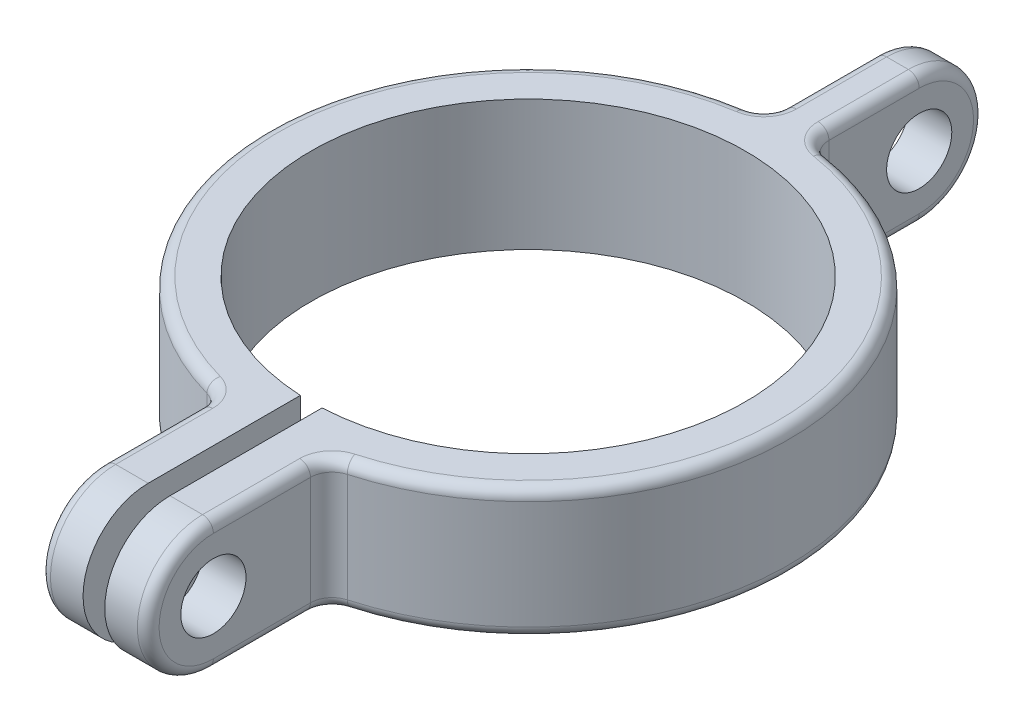
from build123d import *

# Parameters (mm, degrees)
SKETCH1_R          = 38.1
SKETCH1_R_2        = 31.75
EXTRUDE1_DEPTH     = 19.05
SKETCH2_W          = 3.175
SKETCH2_H          = 40.64
CUT_EXTRUDE1_DEPTH = 58.15
EXTRUDE2_DEPTH     = 6.35
SKETCH6_R          = 4.7625
CUT_EXTRUDE3_DEPTH = 81.687067836
EXTRUDE4_DEPTH     = 3.175
FILLET4_R          = 3.175
SKETCH10_R         = 4.7625
CUT_EXTRUDE6_DEPTH = 79.094674114
FILLET5_R          = 1.5875


with BuildPart() as part:
    # Sketch1 → Extrude1 (new body)
    with BuildSketch(Plane(origin=(0, 0, 0), x_dir=(1, 0, 0), z_dir=(0, 1, 0))):
        with Locations(Location((0, 0, 0), (0, 0, 90))):
            Circle(SKETCH1_R)
        with Locations(Location((0, 0, 0), (0, 0, 90))):
            Circle(SKETCH1_R_2, mode=Mode.SUBTRACT)
    extrude(amount=EXTRUDE1_DEPTH)

    # Sketch2 → Cut-Extrude1 (cut, through all)
    with BuildSketch(Plane(origin=(0, 19.05, 0), x_dir=(-1, 0, 0), z_dir=(0, 1, 0))):
        with Locations((0, 20.32)):
            Rectangle(SKETCH2_W, SKETCH2_H)
    extrude(amount=-CUT_EXTRUDE1_DEPTH, mode=Mode.SUBTRACT)

    # Sketch3 → Extrude2 (add)
    with BuildSketch(Plane.ZY.offset(-1.5875)):
        with BuildLine():
            Line((31.710287664, 19.05), (53.941912716, 19.05))
            ThreePointArc((53.941912716, 19.05), (63.466912716, 9.525), (53.941912716, 0))
            Line((53.941912716, 0), (31.710287664, 0))
            Line((31.710287664, 0), (31.710287664, 19.05))
        make_face()
    extrude2 = extrude(amount=-EXTRUDE2_DEPTH)

    # Mirror1: Extrude2 across plane
    add(extrude2.mirror(Plane(origin=(0, 0, 0), x_dir=(0, 0, 1), z_dir=(1, 0, 0))))

    # Sketch6 → Cut-Extrude3 (cut, through all)
    with BuildSketch(Plane(origin=(7.9375, 0, 0), x_dir=(0, 0, -1), z_dir=(1, 0, 0))):
        with Locations((-53.941912716, 9.525)):
            Circle(SKETCH6_R)
    extrude(amount=-CUT_EXTRUDE3_DEPTH, mode=Mode.SUBTRACT)

    # Sketch7 → Extrude4 (add, symmetric)
    with BuildSketch(Plane(origin=(0, 0, 0), x_dir=(0, 0, -1), z_dir=(1, 0, 0))):
        with BuildLine():
            Line((31.75, 19.05), (53.975, 19.05))
            ThreePointArc((53.975, 19.05), (63.5, 9.525), (53.975, 0))
            Line((53.975, 0), (31.75, 0))
            Line((31.75, 0), (31.75, 19.05))
        make_face()
    extrude(amount=EXTRUDE4_DEPTH, both=True)

    # Fillet4
    fillet4_edges = [part.edges().sort_by_distance(p)[0] for p in [
        (7.9375, 9.525, 37.264005337),
        (-7.9375, 9.525, 37.264005337),
        (-3.175, 9.525, -37.967477859),
        (3.175, 9.525, -37.967477859),
    ]]
    fillet(fillet4_edges, radius=FILLET4_R)

    # Sketch10 → Cut-Extrude6 (cut, through all)
    with BuildSketch(Plane(origin=(3.175, 0, 0), x_dir=(0, 0, -1), z_dir=(1, 0, 0))):
        with Locations((53.975, 9.525)):
            Circle(SKETCH10_R)
    extrude(amount=-CUT_EXTRUDE6_DEPTH, mode=Mode.SUBTRACT)

    # Fillet5
    fillet5_edges = [part.edges().sort_by_distance(p)[0] for p in [
        (-38.033554879, 19.05, -2.249156126),
        (-38.033554879, 0, -2.249156126),
        (-7.9375, 0, 46.846430999),
        (38.033554879, 19.05, -2.249156126),
        (38.033554879, 0, -2.249156126),
        (7.9375, 0, 46.846430999),
        (3.175, 0, -47.379306719),
        (-3.175, 0, -47.379306719),
        (-8.583207666, 19.05, 37.831755365),
        (-8.583207666, 0, 37.831755365),
        (8.583207666, 0, 37.831755365),
        (8.583207666, 19.05, 37.831755365),
        (3.938414382, 0, -38.718454894),
        (3.938414382, 19.05, -38.718454894),
        (-3.938414382, 0, -38.718454894),
        (-3.938414382, 19.05, -38.718454894),
        (7.9375, 19.05, 46.846430999),
        (7.9375, 9.525, 63.466912716),
        (-7.9375, 9.525, 63.466912716),
        (-7.9375, 19.05, 46.846430999),
        (3.175, 19.05, -47.379306719),
        (3.175, 9.525, -63.5),
        (-3.175, 19.05, -47.379306719),
        (-3.175, 9.525, -63.5),
    ]]
    fillet(fillet5_edges, radius=FILLET5_R)


solid = part.part
